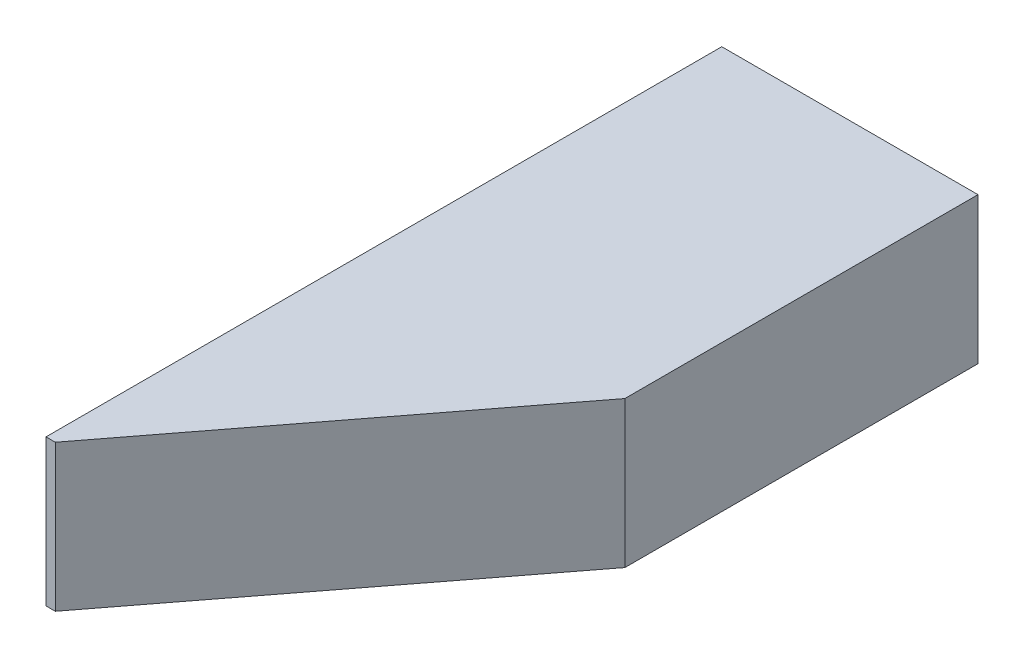
from build123d import *

# Parameters (mm, degrees)
SKETCH2_W               = 101.6
SKETCH2_H               = 50.8
BOSS_EXTRUDE1_DEPTH     = 122.512802726
BOSS_EXTRUDE2_DEPTH     = 50.8
CUT_EXTRUDE1_DEPTH      = 261.524644331
CUT_EXTRUDE1_DEPTH_BACK = 261.524644331
SKETCH4_W               = 12.7
SKETCH4_H               = 234.456585115


with BuildPart() as part:
    # Sketch2 → Boss-Extrude1 (new body)
    with BuildSketch(Plane.XY):
        with Locations((50.8, 25.4)):
            Rectangle(SKETCH2_W, SKETCH2_H)
    extrude(amount=BOSS_EXTRUDE1_DEPTH)

    # Sketch3 → Boss-Extrude2 (add)
    with BuildSketch(Plane(origin=(0, 50.8, 0), x_dir=(1, 0, 0), z_dir=(0, 1, 0))):
        Polygon((101.6, -122.512802726), (15.9196024, -234.456585115), (0, -234.456585115), (0, -122.512802726), align=None)
    extrude(amount=-BOSS_EXTRUDE2_DEPTH)

    # Sketch4 → Cut-Extrude1 (cut, two sides: drawn at the far end of the back side and taken through both)
    with BuildSketch(Plane(origin=(0, 50.8, 0), x_dir=(1, 0, 0), z_dir=(0, 1, 0)).offset(-CUT_EXTRUDE1_DEPTH_BACK)):
        with Locations((6.35, -117.228292558)):
            Rectangle(SKETCH4_W, SKETCH4_H)
    extrude(amount=CUT_EXTRUDE1_DEPTH + CUT_EXTRUDE1_DEPTH_BACK, mode=Mode.SUBTRACT)


solid = part.part
